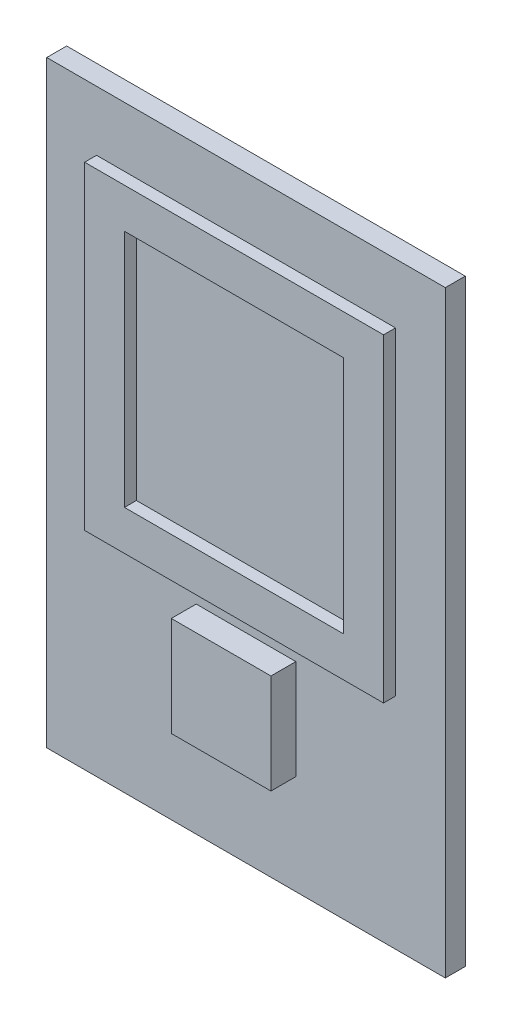
from build123d import *

# Parameters (mm, degrees)
ESQUISSE1_W          = 40
ESQUISSE1_H          = 60
PCB_RFID_RC522_DEPTH = 2
ANTENNE_RFID_START   = 2
ESQUISSE2_W          = 30
ESQUISSE2_H          = 32
ESQUISSE2_W_2        = 22
ESQUISSE2_H_2        = 24
ANTENNE_RFID_DEPTH   = 1.2
PUCE_MFRC522_START   = 2
ESQUISSE3_W          = 10
ESQUISSE3_H          = 10
PUCE_MFRC522_DEPTH   = 2.5
ESQUISSE4_W          = 22
ESQUISSE4_H          = 3
CONNECTEUR_SPI_DEPTH = 5


with BuildPart() as part:
    # Esquisse1 → PCB_RFID_RC522 (new body)
    with BuildSketch(Plane.XY):
        Rectangle(ESQUISSE1_W, ESQUISSE1_H)
    extrude(amount=PCB_RFID_RC522_DEPTH)

    # Esquisse2 → Antenne_RFID (add)
    with BuildSketch(Plane.XY.offset(ANTENNE_RFID_START)):
        with Locations((0, 8)):
            Rectangle(ESQUISSE2_W, ESQUISSE2_H)
        with Locations((0, 8)):
            Rectangle(ESQUISSE2_W_2, ESQUISSE2_H_2, mode=Mode.SUBTRACT)
    extrude(amount=ANTENNE_RFID_DEPTH)

    # Esquisse3 → Puce_MFRC522 (add)
    with BuildSketch(Plane.XY.offset(PUCE_MFRC522_START)):
        with Locations((0, -15)):
            Rectangle(ESQUISSE3_W, ESQUISSE3_H)
    extrude(amount=PUCE_MFRC522_DEPTH)

    # Esquisse4 → Connecteur_SPI (add)
    with BuildSketch(Plane.XY):
        with Locations((0, -27.5)):
            Rectangle(ESQUISSE4_W, ESQUISSE4_H)
    extrude(amount=-CONNECTEUR_SPI_DEPTH)


solid = part.part
